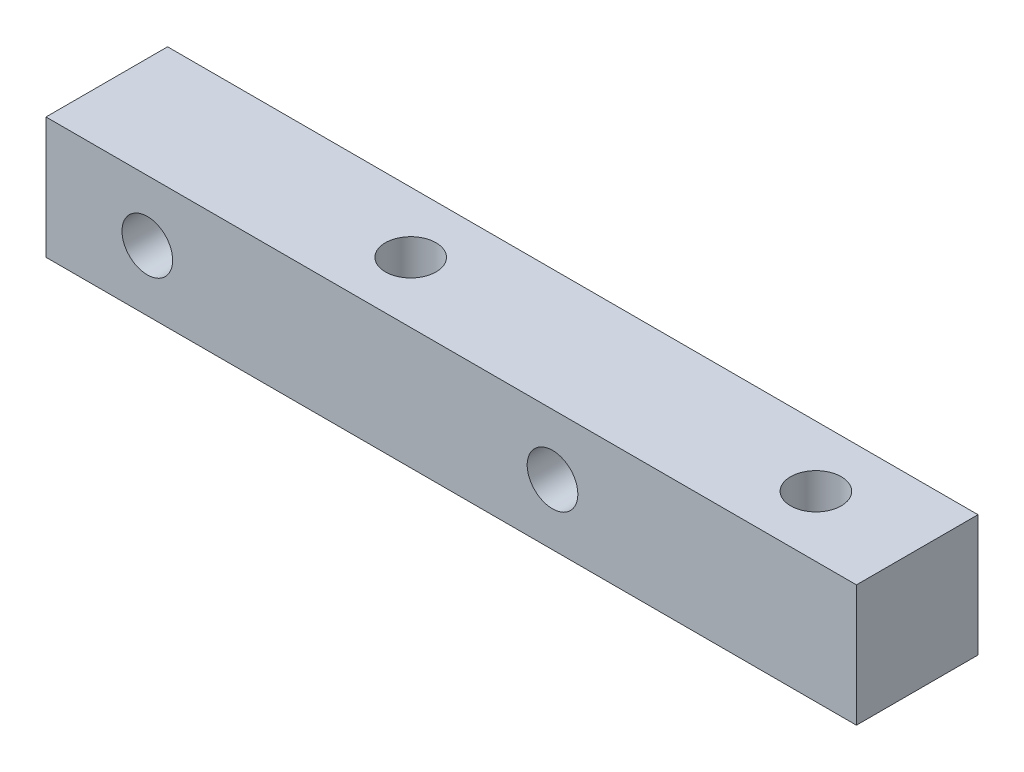
from build123d import *

# Parameters (mm, degrees)
SKETCH_1_W             = 40
SKETCH_1_H             = 6
EXTRUDE_1_DEPTH        = 6
HOLE_WIZARD_M3_1_D     = 2.5
HOLE_WIZARD_M3_1_DEPTH = 10.5
HOLE_WIZARD_M3_1_TIP   = 0.751075774
HOLE_WIZARD_M3_2_D     = 2.5
HOLE_WIZARD_M3_2_DEPTH = 10.5
HOLE_WIZARD_M3_2_TIP   = 0.751075774


with BuildPart() as part:
    # 草图1 → 凸台-拉伸1 (new body)
    with BuildSketch(Plane.XY):
        Rectangle(SKETCH_1_W, SKETCH_1_H)
    extrude(amount=EXTRUDE_1_DEPTH)

    # M3 螺纹孔1
    with Locations(Plane.XY.offset(6)):
        with Locations((-15, 0), (5, 0)):
            Hole(HOLE_WIZARD_M3_1_D / 2, depth=HOLE_WIZARD_M3_1_DEPTH)
            with Locations((0, 0, -(HOLE_WIZARD_M3_1_DEPTH + HOLE_WIZARD_M3_1_TIP / 2))):  # 118° drill point
                Cone(0, HOLE_WIZARD_M3_1_D / 2, HOLE_WIZARD_M3_1_TIP, mode=Mode.SUBTRACT)

    # M3 螺纹孔2
    with Locations(Plane(origin=(0, 3, 0), x_dir=(1, 0, 0), z_dir=(0, 1, 0))):
        with Locations((-5, -3), (15, -3)):
            Hole(HOLE_WIZARD_M3_2_D / 2, depth=HOLE_WIZARD_M3_2_DEPTH)
            with Locations((0, 0, -(HOLE_WIZARD_M3_2_DEPTH + HOLE_WIZARD_M3_2_TIP / 2))):  # 118° drill point
                Cone(0, HOLE_WIZARD_M3_2_D / 2, HOLE_WIZARD_M3_2_TIP, mode=Mode.SUBTRACT)


solid = part.part
